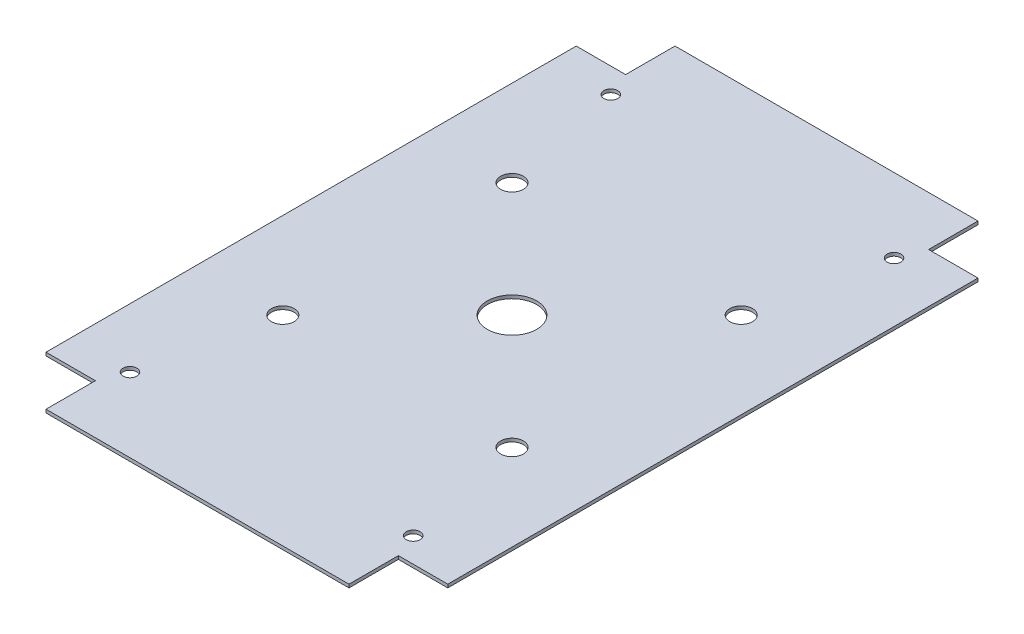
from build123d import *

# Parameters (mm, degrees)
SKETCH1_R           = 3.45
SKETCH1_R_2         = 7.5
SKETCH1_R_3         = 2.1
BOSS_EXTRUDE1_DEPTH = 1


with BuildPart() as part:
    # Sketch1 → Boss-Extrude1 (new body)
    with BuildSketch(Plane(origin=(0, 0, 0), x_dir=(1, 0, 0), z_dir=(0, 1, 0))):
        Polygon((-46, -80.5), (-61, -80.5), (-61, 80.5), (-46, 80.5), (-46, 95.5), (46, 95.5), (46, 80.5), (61, 80.5), (61, -80.5), (46, -80.5), (46, -95.5), (-46, -95.5), align=None)
        with Locations(Location((-34.8, 34.8, 0), (0, 0, 270))):
            Circle(SKETCH1_R, mode=Mode.SUBTRACT)
        with Locations(Location((34.8, 34.8, 0), (0, 0, 270))):
            Circle(SKETCH1_R, mode=Mode.SUBTRACT)
        with Locations(Location((34.8, -34.8, 0), (0, 0, 270))):
            Circle(SKETCH1_R, mode=Mode.SUBTRACT)
        with Locations(Location((-34.8, -34.8, 0), (0, 0, 270))):
            Circle(SKETCH1_R, mode=Mode.SUBTRACT)
        with Locations(Location((0, 0, 0), (0, 0, 270))):
            Circle(SKETCH1_R_2, mode=Mode.SUBTRACT)
        with Locations(Location((-43, -73, 0), (0, 0, 270))):
            Circle(SKETCH1_R_3, mode=Mode.SUBTRACT)
        with Locations(Location((43, -73, 0), (0, 0, 270))):
            Circle(SKETCH1_R_3, mode=Mode.SUBTRACT)
        with Locations(Location((-43, 73, 0), (0, 0, 270))):
            Circle(SKETCH1_R_3, mode=Mode.SUBTRACT)
        with Locations(Location((43, 73, 0), (0, 0, 270))):
            Circle(SKETCH1_R_3, mode=Mode.SUBTRACT)
    extrude(amount=BOSS_EXTRUDE1_DEPTH)


solid = part.part
